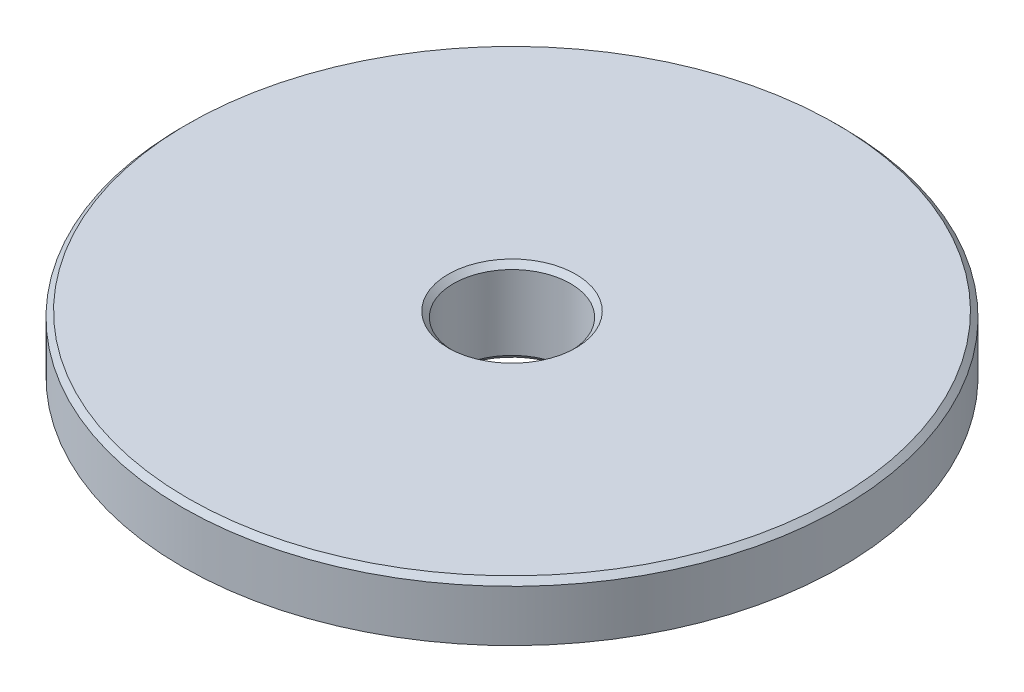
from build123d import *

# Parameters (mm, degrees)
SKETCH3_R          = 3.275
CUT_EXTRUDE1_DEPTH = 27.529839572
CHAMFER1_SIZE      = 0.3


with BuildPart() as part:
    # Sketch2 → Revolve1 (revolve)
    with BuildSketch(Plane.XY, mode=Mode.PRIVATE) as revolve1_sk:
        with BuildLine():
            Line((0, 0), (0, 4.7625))
            Line((0, 4.7625), (18.4546875, 4.7625))
            Line((18.4546875, 4.7625), (18.4546875, 1.5875))
            Line((18.4546875, 1.5875), (15.2796875, 1.5875))
            ThreePointArc((15.2796875, 1.5875), (14.940933498, 1.727816502), (15.08125, 1.3890625))
            Line((15.08125, 1.3890625), (15.08125, 0))
            Line((15.08125, 0), (0, 0))
        make_face()
    revolve(revolve1_sk.sketch.rotate(Axis((0, 0, 0), (0, 1, 0)), 90), axis=Axis((0, 0, 0), (0, 1, 0)))

    # Sketch3 → Cut-Extrude1 (cut, through all)
    with BuildSketch(Plane(origin=(0, 0, 0), x_dir=(-1, 0, 0), z_dir=(0, -1, 0))):
        with Locations(Location((0, 0, 0), (0, 0, 90))):
            Circle(SKETCH3_R)
    extrude(amount=-CUT_EXTRUDE1_DEPTH, mode=Mode.SUBTRACT)

    # Chamfer1
    chamfer1_edges = [part.edges().sort_by_distance(p)[0] for p in [
        (0, 4.7625, 3.275),
        (0, 0, 3.275),
        (0, 4.7625, 18.4546875),
        (0, 0, 15.08125),
    ]]
    chamfer(chamfer1_edges, length=CHAMFER1_SIZE)


solid = part.part
